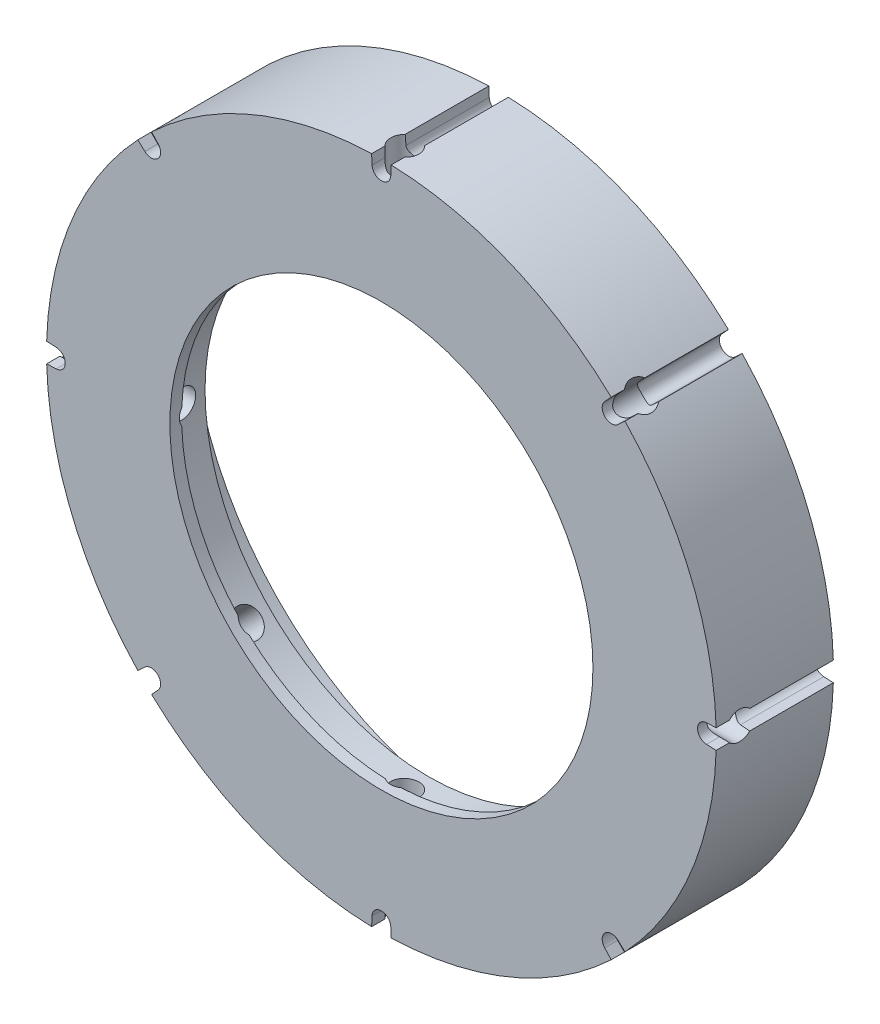
from build123d import *

# Parameters (mm, degrees)
SKETCH1_R           = 14.2875
SKETCH1_R_2         = 13.15
BOSS_EXTRUDE1_DEPTH = 3
BOSS_EXTRUDE2_START = 2
SKETCH2_R           = 14.2875
SKETCH2_R_2         = 9.025
BOSS_EXTRUDE2_DEPTH = 2
SKETCH4_R           = 9.525
CUT_EXTRUDE2_DEPTH  = 1.5
SKETCH5_R           = 0.4
CUT_EXTRUDE4_DEPTH  = 21.815026123
CUT_EXTRUDE5_DEPTH  = 10
CIRPATTERN1_COUNT   = 8


with BuildPart() as part:
    # Sketch1 → Boss-Extrude1 (new body)
    with BuildSketch(Plane.XY):
        Circle(SKETCH1_R)
        Circle(SKETCH1_R_2, mode=Mode.SUBTRACT)
    extrude(amount=-BOSS_EXTRUDE1_DEPTH)

    # Sketch2 → Boss-Extrude2 (add)
    with BuildSketch(Plane.XY.offset(BOSS_EXTRUDE2_START)):
        Circle(SKETCH2_R)
        Circle(SKETCH2_R_2, mode=Mode.SUBTRACT)
    extrude(amount=-BOSS_EXTRUDE2_DEPTH)

    # Sketch4 → Cut-Extrude2 (cut)
    with BuildSketch(Plane(origin=(0, 0, 0), x_dir=(-1, 0, 0), z_dir=(0, 0, -1))):
        Circle(SKETCH4_R)
    extrude(amount=-CUT_EXTRUDE2_DEPTH, mode=Mode.SUBTRACT)

    # Sketch5 → Cut-Extrude4 (cut, through all)
    with BuildSketch(Plane(origin=(0, 0, -3), x_dir=(-1, 0, 0), z_dir=(0, 0, -1))):
        with Locations((-13.8875, 0)):
            Circle(SKETCH5_R)
        with BuildLine():
            ThreePointArc((-14.2875, 1.1e-08), (-14.164417622, 0.288646204), (-13.870916856, 0.399656101))
            Line((-13.870916856, 0.399656101), (-14.281422414, 0.416689427))
            ThreePointArc((-14.281422414, 0.416689427), (-14.285980523, 0.208366879), (-14.2875, 1.1e-08))
        make_face()
        with BuildLine():
            ThreePointArc((-13.870916856, -0.399656101), (-14.164417629, -0.288646196), (-14.2875, 1.1e-08))
            ThreePointArc((-14.2875, 1.1e-08), (-14.285980523, -0.208366868), (-14.281422414, -0.416689427))
            Line((-14.281422414, -0.416689427), (-13.870916856, -0.399656101))
        make_face()
    cut_extrude4 = extrude(amount=-CUT_EXTRUDE4_DEPTH, mode=Mode.SUBTRACT)

    # Sketch6 → Cut-Extrude5 (cut)
    with BuildSketch(Plane(origin=(14.281422414, 0, 0), x_dir=(0, 0, -1), z_dir=(1, 0, 0))):
        with BuildLine():
            ThreePointArc((-0.568294173, 0.416689427), (-1, 0.6), (-1.431705827, 0.416689427))
            Line((-1.431705827, 0.416689427), (-0.568294173, 0.416689427))
        make_face()
        with BuildLine():
            Line((-0.568294173, 0.416689427), (-1.431705827, 0.416689427))
            ThreePointArc((-1.431705827, 0.416689427), (-1.22469591, -0.5563378), (-0.4, 0))
            ThreePointArc((-0.4, 0), (-0.4436622, 0.22469591), (-0.568294173, 0.416689427))
        make_face()
    cut_extrude5 = extrude(amount=-CUT_EXTRUDE5_DEPTH, mode=Mode.SUBTRACT)

    # CirPattern1: Cut-Extrude4, Cut-Extrude5 ×8 about axis
    cirpattern1_axis = Axis((0, 0, 0), (0, 0, 1))
    add([cut_extrude4.rotate(cirpattern1_axis, i * 360 / CIRPATTERN1_COUNT) for i in range(1, CIRPATTERN1_COUNT)], mode=Mode.SUBTRACT)
    add([cut_extrude5.rotate(cirpattern1_axis, i * 360 / CIRPATTERN1_COUNT) for i in range(1, CIRPATTERN1_COUNT)], mode=Mode.SUBTRACT)


solid = part.part
